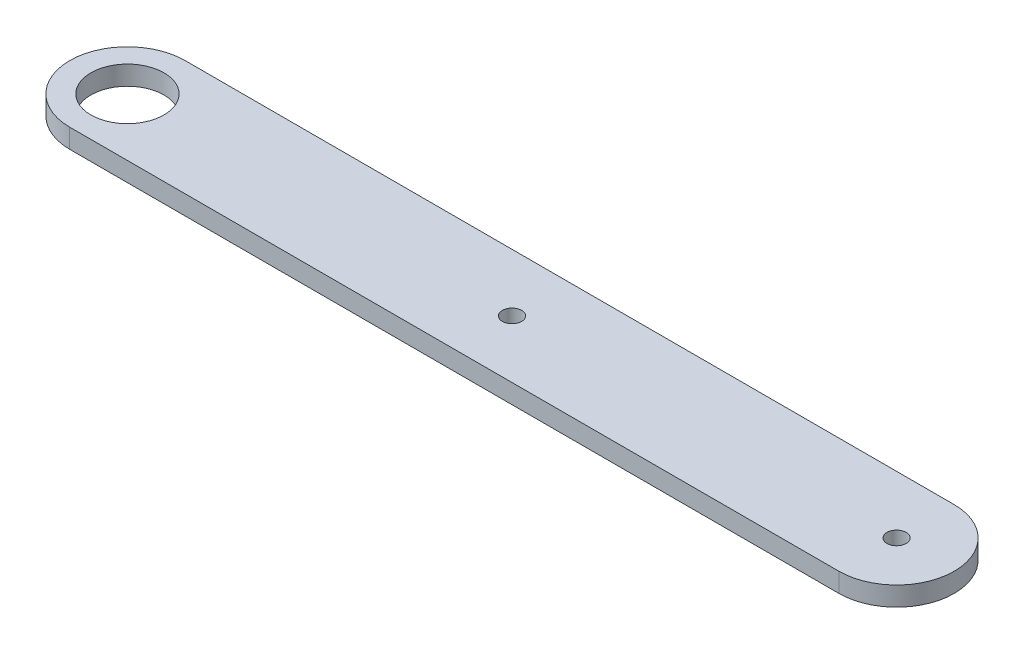
from build123d import *

# Parameters (mm, degrees)
SKETCH_1_R      = 2.5
SKETCH_1_R_2    = 9.5
EXTRUDE_1_DEPTH = 5


with BuildPart() as part:
    # 草图1 → 凸台-拉伸1 (new body)
    with BuildSketch(Plane(origin=(0, 0, 0), x_dir=(1, 0, 0), z_dir=(0, 1, 0))):
        with BuildLine():
            Line((0, 15), (200, 15))
            ThreePointArc((200, 15), (215, 0), (200, -15))
            Line((200, -15), (0, -15))
            ThreePointArc((0, -15), (-15, 0), (0, 15))
        make_face()
        with Locations(Location((200, 0, 0), (0, 0, 270))):
            Circle(SKETCH_1_R, mode=Mode.SUBTRACT)
        with Locations(Location((100, 0, 0), (0, 0, 270))):
            Circle(SKETCH_1_R, mode=Mode.SUBTRACT)
        with Locations(Location((0, 0, 0), (0, 0, 270))):
            Circle(SKETCH_1_R_2, mode=Mode.SUBTRACT)
    extrude(amount=EXTRUDE_1_DEPTH)


solid = part.part
